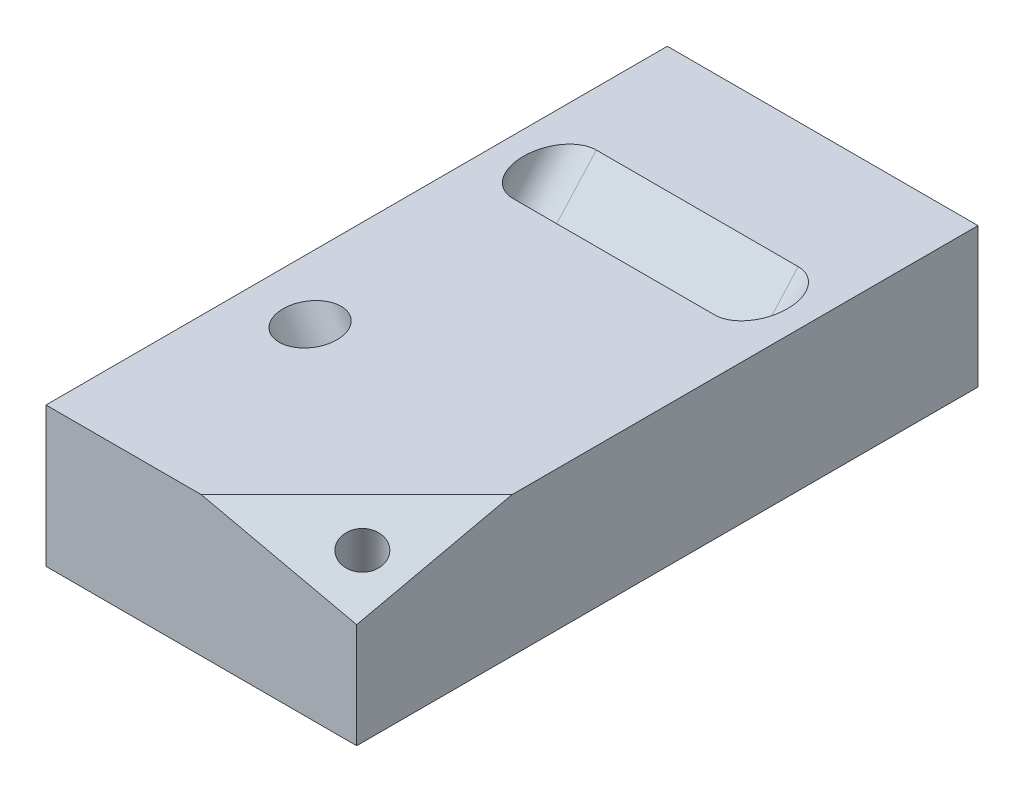
from build123d import *

# Parameters (mm, degrees)
SKETCH1_W           = 200
SKETCH1_H           = 400
BOSS_EXTRUDE1_DEPTH = 90
CUT_EXTRUDE2_DEPTH  = 289.26854046
SKETCH4_3_R         = 12.5
CUT_EXTRUDE4_DEPTH  = 289.26854046
SKETCH10_RX         = 20
SKETCH10_RY         = 15
CUT_EXTRUDE5_DEPTH  = 100
CUT_EXTRUDE6_DEPTH  = 380.479144091


with BuildPart() as part:
    # Sketch1 → Boss-Extrude1 (new body)
    with BuildSketch(Plane(origin=(0, 0, 0), x_dir=(1, 0, 0), z_dir=(0, 1, 0))):
        Rectangle(SKETCH1_W, SKETCH1_H)
    extrude(amount=BOSS_EXTRUDE1_DEPTH)

    # Sketch4 → Cut-Extrude2 (cut, through all)
    with BuildSketch(Plane(origin=(27.582292849, 122.587968218, 27.582292849), x_dir=(-0.9767443431718839, 0.20917784862693525, 0.04706501594106042), z_dir=(-0.21440729484260865, -0.9529213104115941, -0.21440729484260865))):
        Polygon((28.239009565, -175.365853659), (-74.141926347, -77.804878049), (-74.141926347, -180.304878049), align=None)
    extrude(amount=-CUT_EXTRUDE2_DEPTH, mode=Mode.SUBTRACT)

    # Sketch4<3> → Cut-Extrude4 (cut, through all)
    with BuildSketch(Plane(origin=(27.582292849, 122.587968218, 27.582292849), x_dir=(-0.9767443431718839, 0.20917784862693525, 0.04706501594106042), z_dir=(-0.21440729484260865, -0.9529213104115941, -0.21440729484260865))):
        with Locations((-46.760990435, -147.804878049)):
            Circle(SKETCH4_3_R)
    extrude(amount=CUT_EXTRUDE4_DEPTH, mode=Mode.SUBTRACT)

    # Sketch10 → Cut-Extrude5 (cut)
    with BuildSketch(Plane(origin=(-63.97114317, 110.801270189, 0), x_dir=(0, 0, 1), z_dir=(-0.500000000000001, 0.866025403784438, 0))):
        with Locations(Location((70, -6.961524227), (0, 0, 180))):
            Ellipse(SKETCH10_RX, SKETCH10_RY)
    extrude(amount=-CUT_EXTRUDE5_DEPTH, mode=Mode.SUBTRACT)

    # Sketch11 → Cut-Extrude6 (cut, through all)
    with BuildSketch(Plane(origin=(0, 149.155970384, -134.300638965), x_dir=(-1, 0, 0), z_dir=(0, 0.7431448254773932, -0.6691306063588595))):
        with BuildLine():
            Line((-65, 11.592789477), (65, 11.592789477))
            ThreePointArc((65, 11.592789477), (85, -8.407210523), (65, -28.407210523))
            Line((65, -28.407210523), (-65, -28.407210523))
            ThreePointArc((-65, -28.407210523), (-85, -8.407210523), (-65, 11.592789477))
        make_face()
    extrude(amount=-CUT_EXTRUDE6_DEPTH, mode=Mode.SUBTRACT)


solid = part.part
